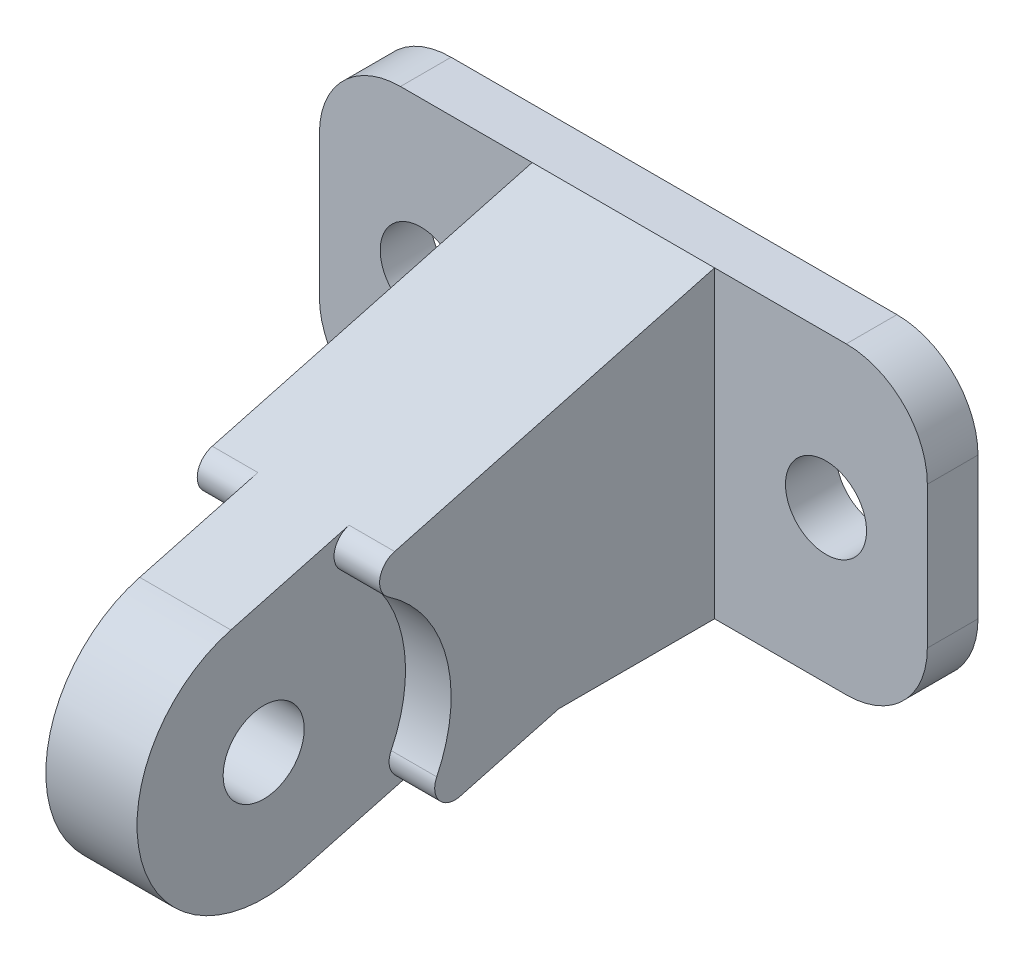
from build123d import *

# Parameters (mm, degrees)
SKETCH1_W            = 60
SKETCH1_H            = 30
SKETCH1_R            = 4
BOSS_EXTRUDE1_DEPTH  = 2.5
FILLET1_R            = 8
SKETCH3_R            = 4
BOSS_EXTRUDE2_DEPTH  = 9
SKETCH4_R            = 14
CUT_EXTRUDE1_DEPTH   = 4.5
FILLET2_R            = 2
FILLET2_OF_MIRROR1_R = 2


with BuildPart() as part:
    # Sketch1 → Boss-Extrude1 (new, symmetric)
    with BuildSketch(Plane.XY):
        Rectangle(SKETCH1_W, SKETCH1_H)
        with Locations((-20, 0)):
            Circle(SKETCH1_R, mode=Mode.SUBTRACT)
        with Locations(Location((20, 0, 0), (0, 0, 180))):
            Circle(SKETCH1_R, mode=Mode.SUBTRACT)
    extrude(amount=BOSS_EXTRUDE1_DEPTH, both=True)

    # Fillet1
    fillet1_edges = [part.edges().sort_by_distance(p)[0] for p in [
        (30, -15, 0),
        (-30, -15, 0),
        (-30, 15, 0),
        (30, 15, 0),
    ]]
    fillet(fillet1_edges, radius=FILLET1_R)

    # Sketch3 → Boss-Extrude2 (add, symmetric)
    with BuildSketch(Plane(origin=(0, 0, 0), x_dir=(0, 0, -1), z_dir=(1, 0, 0))):
        with BuildLine():
            Line((-2.5, 15), (-45.735238064, 3.415152876))
            ThreePointArc((-45.735238064, 3.415152876), (-54.574072829, -11.894158016), (-39.264761936, -20.732992781))
            Line((-39.264761936, -20.732992781), (-17.868941598, -15))
            Line((-17.868941598, -15), (-2.5, -15))
            Line((-2.5, -15), (-2.5, 15))
        make_face()
        with Locations((-42.5, -8.658919952)):
            Circle(SKETCH3_R, mode=Mode.SUBTRACT)
    extrude(amount=BOSS_EXTRUDE2_DEPTH, both=True)

    # Sketch4 → Cut-Extrude1 (cut)
    with BuildSketch(Plane(origin=(9, 0, 0), x_dir=(0, 0, -1), z_dir=(1, 0, 0))):
        with Locations((-42.5, -8.658919952)):
            Circle(SKETCH4_R)
    cut_extrude1 = extrude(amount=-CUT_EXTRUDE1_DEPTH, mode=Mode.SUBTRACT)

    # Fillet2
    fillet2_edges = [part.edges().sort_by_distance(p)[0] for p in [
        (6.75, -19.101200791, 33.174831321),
        (6.75, 5.046944867, 39.645307448),
    ]]
    fillet(fillet2_edges, radius=FILLET2_R)

    # Mirror1: Cut-Extrude1 across plane
    add(cut_extrude1.mirror(Plane(origin=(0, 0, 0), x_dir=(0, 0, 1), z_dir=(1, 0, 0))), mode=Mode.SUBTRACT)

    # Fillet2 of Mirror1
    fillet2_of_mirror1_edges = [part.edges().sort_by_distance(p)[0] for p in [
        (-6.75, -19.101200791, 33.174831321),
        (-6.75, 5.046944867, 39.645307448),
    ]]
    fillet(fillet2_of_mirror1_edges, radius=FILLET2_OF_MIRROR1_R)


solid = part.part
